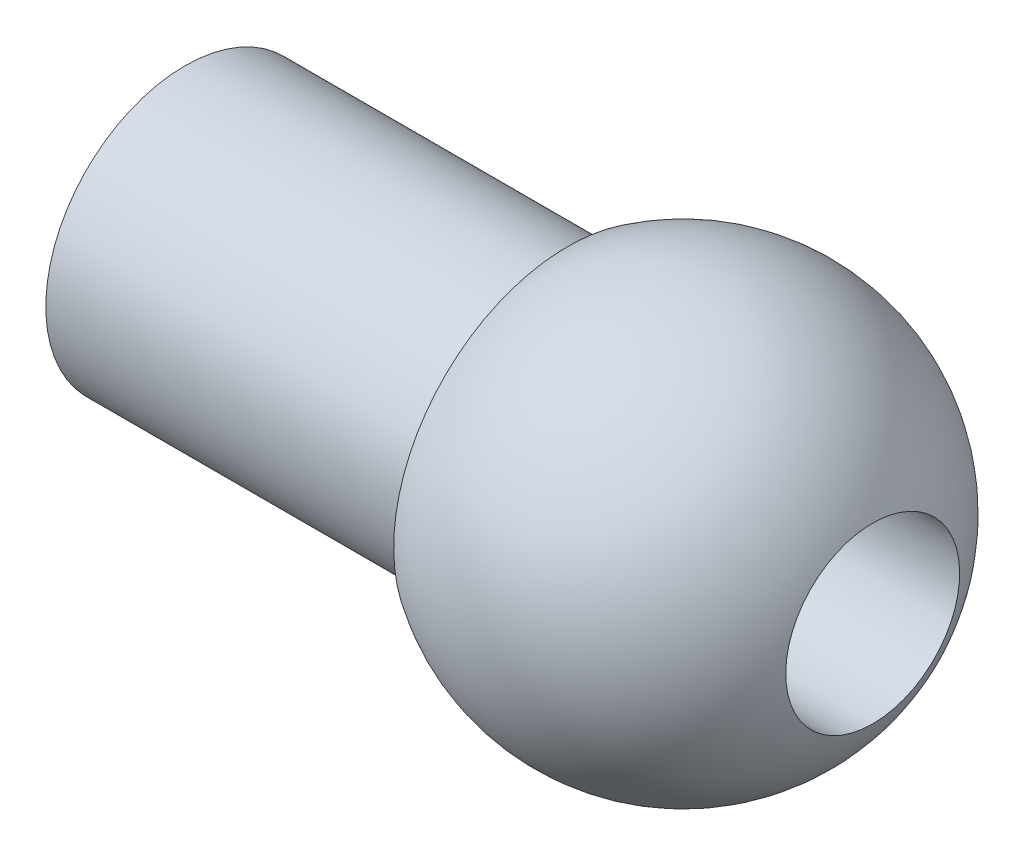
from build123d import *

# Parameters (mm, degrees)
SKETCH2_R          = 2.5
CUT_EXTRUDE1_DEPTH = 23.017385014


with BuildPart() as part:
    # Sketch1 → Revolve1 (revolve)
    with BuildSketch(Plane.XY, mode=Mode.PRIVATE) as revolve1_sk:
        with BuildLine():
            Line((0, 0), (0, 4))
            Line((0, 4), (11, 4))
            Line((11, 4), (11, 5))
            ThreePointArc((11, 5), (17.153899121, 5.286764074), (20.31662479, 0))
            Line((20.31662479, 0), (0, 0))
        make_face()
    revolve(revolve1_sk.sketch.rotate(Axis((-20.016934907, 0, 0), (1, 0, 0)), 180), axis=Axis((-20.016934907, 0, 0), (1, 0, 0)))

    # Sketch2 → Cut-Extrude1 (cut, through all)
    with BuildSketch(Plane.ZY):
        with Locations(Location((0, 0, 0), (0, 0, 270))):
            Circle(SKETCH2_R)
    extrude(amount=-CUT_EXTRUDE1_DEPTH, mode=Mode.SUBTRACT)


solid = part.part
